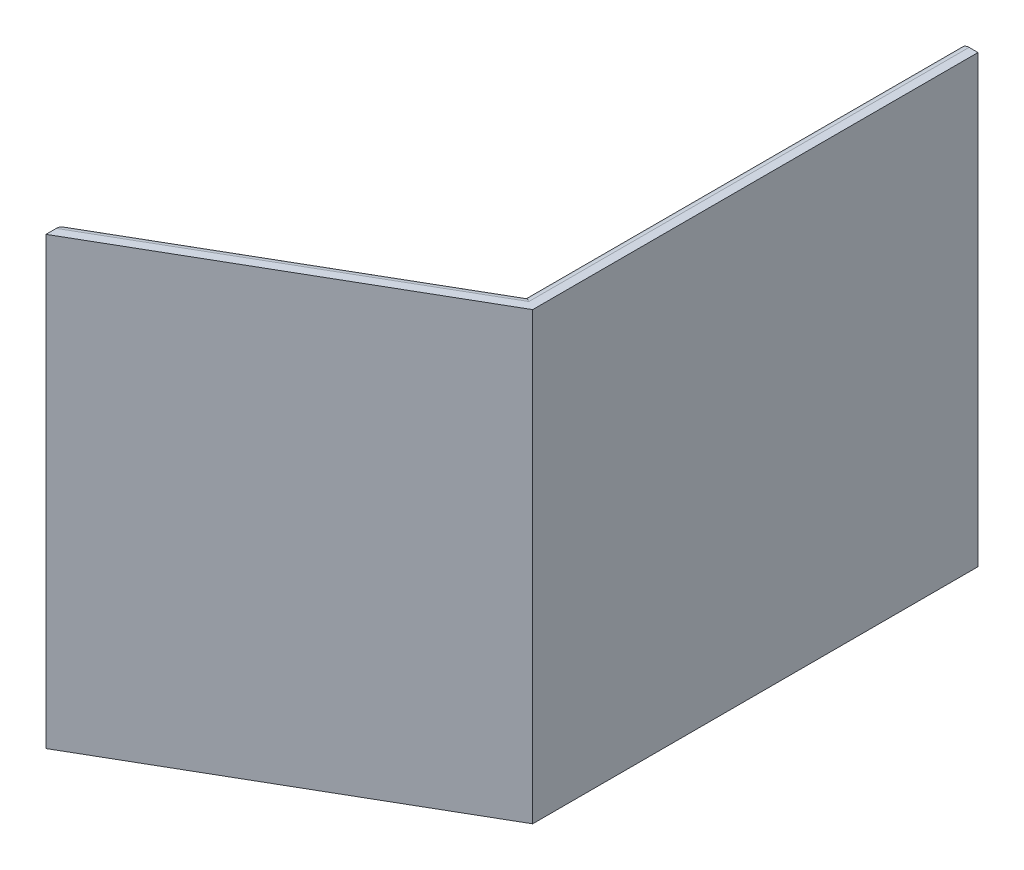
from build123d import *

# Parameters (mm, degrees)
BOSS_EXTRUDE1_DEPTH = 50
CUT_EXTRUDE1_DEPTH  = 48
FILLET1_R           = 1
FILLET2_R           = 2
SKETCH3_R           = 1.6
CUT_EXTRUDE2_DEPTH  = 1067.768955656


with BuildPart() as part:
    # Sketch1 → Boss-Extrude1 (new body)
    with BuildSketch(Plane(origin=(0, 0, 0), x_dir=(1, 0, 0), z_dir=(0, 1, 0))):
        Polygon((1026.361248777, 29.83084978), (1061.002264928, 49.83084978), (1061.002264928, 99.83084978), (1049.002264928, 99.83084978), (1049.002264928, 56.75905301), (1026.361248777, 43.68725624), align=None)
    extrude(amount=BOSS_EXTRUDE1_DEPTH)

    # Sketch2 → Cut-Extrude1 (cut)
    with BuildSketch(Plane(origin=(0, 50, 0), x_dir=(1, 0, 0), z_dir=(0, 1, 0))):
        Polygon((1059.002264928, 99.83084978), (1059.002264928, 50.985550318), (1026.361248777, 32.140250857), (1013.240003321, 83.162287717), (1049.002264928, 102.282604927), align=None)
    extrude(amount=-CUT_EXTRUDE1_DEPTH, mode=Mode.SUBTRACT)

    # Fillet1
    fillet1_edges = [part.edges().sort_by_distance(p)[0] for p in [
        (1037.681756852, 2, -50.223154625),
        (1049.002264928, 2, -78.294951395),
        (1042.681756852, 50, -41.562900587),
        (1059.002264928, 50, -75.408200049),
    ]]
    fillet(fillet1_edges, radius=FILLET1_R)

    # Fillet2
    fillet2_edges = [part.edges().sort_by_distance(p)[0] for p in [
        (1059.002264928, 2, -75.408200049),
        (1042.681756852, 2, -41.562900587),
    ]]
    fillet(fillet2_edges, radius=FILLET2_R)

    # Sketch3 → Cut-Extrude2 (cut, through all)
    with BuildSketch(Plane(origin=(0, 2, 0), x_dir=(1, 0, 0), z_dir=(0, 1, 0))):
        with Locations(Location((1039.942264928, 46.332107148, 0), (0, 0, 270))):
            Circle(SKETCH3_R)
        with Locations(Location((1053.502264928, 59.83084978, 0), (0, 0, 270))):
            Circle(SKETCH3_R)
        with Locations(Location((1053.502264928, 89.83084978, 0), (0, 0, 270))):
            Circle(SKETCH3_R)
    extrude(amount=-CUT_EXTRUDE2_DEPTH, mode=Mode.SUBTRACT)


solid = part.part
